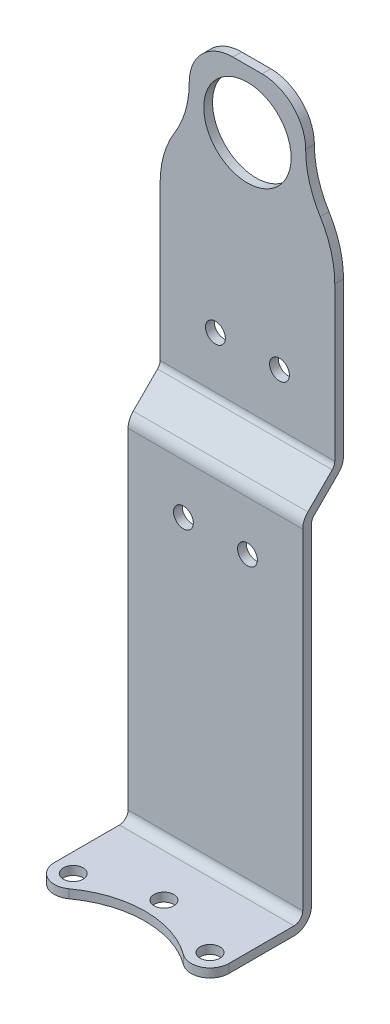
from build123d import *

# Parameters (mm, degrees)
EXTRUDE_1_DEPTH             = 1.5
SKETCH_2_W                  = 30
SKETCH_2_H                  = 7
EXTRUDE_2_DEPTH             = 117
CUT_EXTRUDE_1_DEPTH         = 93.104529713
CUT_EXTRUDE_2_DEPTH         = 89.933295899
CUT_EXTRUDE_3_DEPTH         = 89.933295899
CUT_EXTRUDE_4_DEPTH         = 93.104529713
HOLE_WIZARD_3_4_3_4_1_D     = 3.4
HOLE_WIZARD_3_4_3_4_1_DEPTH = 7
HOLE_WIZARD_3_4_3_4_2_D     = 3.4
HOLE_WIZARD_3_4_3_4_3_D     = 3.4
HOLE_WIZARD_15_0_15_1_D     = 15
FILLET_1_R                  = 1.5
FILLET_2_R                  = 3
FILLET_3_R                  = 7.5


with BuildPart() as part:
    # 草图1 → 凸台-拉伸1 (new body)
    with BuildSketch(Plane(origin=(0, -32, 0), x_dir=(1, 0, 0), z_dir=(0, 1, 0))):
        with BuildLine():
            Line((-15, 4), (-15, -15.677345132))
            ThreePointArc((-15, -15.677345132), (-13.223342916, -18.57419871), (-9.835839599, -18.303842792))
            ThreePointArc((-9.835839599, -18.303842792), (0, -15.1), (9.835839599, -18.303842792))
            ThreePointArc((9.835839599, -18.303842792), (13.223342916, -18.57419871), (15, -15.677345132))
            Line((15, -15.677345132), (15, 4))
            Line((15, 4), (-15, 4))
        make_face()
    extrude(amount=-EXTRUDE_1_DEPTH)

    # 草图2 → 凸台-拉伸2 (add)
    with BuildSketch(Plane(origin=(0, -32, 0), x_dir=(-1, 0, 0), z_dir=(0, 1, 0))):
        with Locations((0, -0.5)):
            Rectangle(SKETCH_2_W, SKETCH_2_H)
    extrude(amount=EXTRUDE_2_DEPTH)

    # 草图3 → 切除-拉伸1 (cut, through all)
    with BuildSketch(Plane.ZY.offset(15)):
        Polygon((3, 85), (-2.5, 85), (-2.5, 33), (3, 27.5), align=None)
    extrude(amount=-CUT_EXTRUDE_1_DEPTH, mode=Mode.SUBTRACT)

    # 草图4 → 切除-拉伸2 (cut, through all)
    with BuildSketch(Plane.XY.offset(-2.5)):
        with BuildLine():
            Line((-11.795428312, 85), (-15, 85))
            Line((-15, 85), (-15, 60))
            ThreePointArc((-15, 60), (-14.362740383, 64.550068681), (-12.5, 68.75))
            ThreePointArc((-12.5, 68.75), (-10.015546325, 76.782552918), (-11.795428312, 85))
        make_face()
    extrude(amount=-CUT_EXTRUDE_2_DEPTH, mode=Mode.SUBTRACT)

    # 草图5 → 切除-拉伸3 (cut, through all)
    with BuildSketch(Plane.XY.offset(-2.5)):
        with BuildLine():
            Line((15, 85), (11.795428312, 85))
            ThreePointArc((11.795428312, 85), (10.015546325, 76.782552918), (12.5, 68.75))
            ThreePointArc((12.5, 68.75), (14.362740383, 64.550068681), (15, 60))
            Line((15, 60), (15, 85))
        make_face()
    extrude(amount=-CUT_EXTRUDE_3_DEPTH, mode=Mode.SUBTRACT)

    # 草图6 → 切除-拉伸4 (cut, through all)
    with BuildSketch(Plane.ZY.offset(15)):
        Polygon((1.5, -33.5), (1.5, 26.878679656), (-4, 32.378679656), (-4, -33.5), align=None)
    extrude(amount=-CUT_EXTRUDE_4_DEPTH, mode=Mode.SUBTRACT)

    # Ø3.4 (3.4) 直径孔1
    with Locations(Plane.XY.offset(3)):
        with Locations((-5.5, 17.757359313), (5.5, 17.757359313)):
            Hole(HOLE_WIZARD_3_4_3_4_1_D / 2, depth=HOLE_WIZARD_3_4_3_4_1_DEPTH)

    # Ø3.4 (3.4) 直径孔2 (through all)
    with Locations(Plane.XY.offset(-2.5)):
        with Locations((-5.5, 42.5), (5.5, 42.5)):
            Hole(HOLE_WIZARD_3_4_3_4_2_D / 2)

    # Ø3.4 (3.4) 直径孔3 (through all)
    with Locations(Plane(origin=(0, -32, 0), x_dir=(1, 0, 0), z_dir=(0, 1, 0))):
        with Locations((-11.75, -15.677345132), (0, -11.85), (11.75, -15.677345132)):
            Hole(HOLE_WIZARD_3_4_3_4_3_D / 2)

    # Ø15.0 (15) 直径孔1 (through all)
    with Locations(Plane.XY.offset(-2.5)):
        with Locations((0, 75)):
            Hole(HOLE_WIZARD_15_0_15_1_D / 2)

    # 圆角1
    fillet_1_edges = [part.edges().sort_by_distance(p)[0] for p in [
        (0, -32, 3),
        (0, 33, -2.5),
        (0, 26.878679656, 1.5),
    ]]
    fillet(fillet_1_edges, radius=FILLET_1_R)

    # 圆角2
    fillet_2_edges = [part.edges().sort_by_distance(p)[0] for p in [
        (0, 27.5, 3),
        (0, -33.5, 1.5),
        (0, 32.378679656, -4),
    ]]
    fillet(fillet_2_edges, radius=FILLET_2_R)

    # 圆角3
    fillet_3_edges = [part.edges().sort_by_distance(p)[0] for p in [
        (-11.795428312, 85, -3.25),
        (11.795428312, 85, -3.25),
    ]]
    fillet(fillet_3_edges, radius=FILLET_3_R)


solid = part.part
